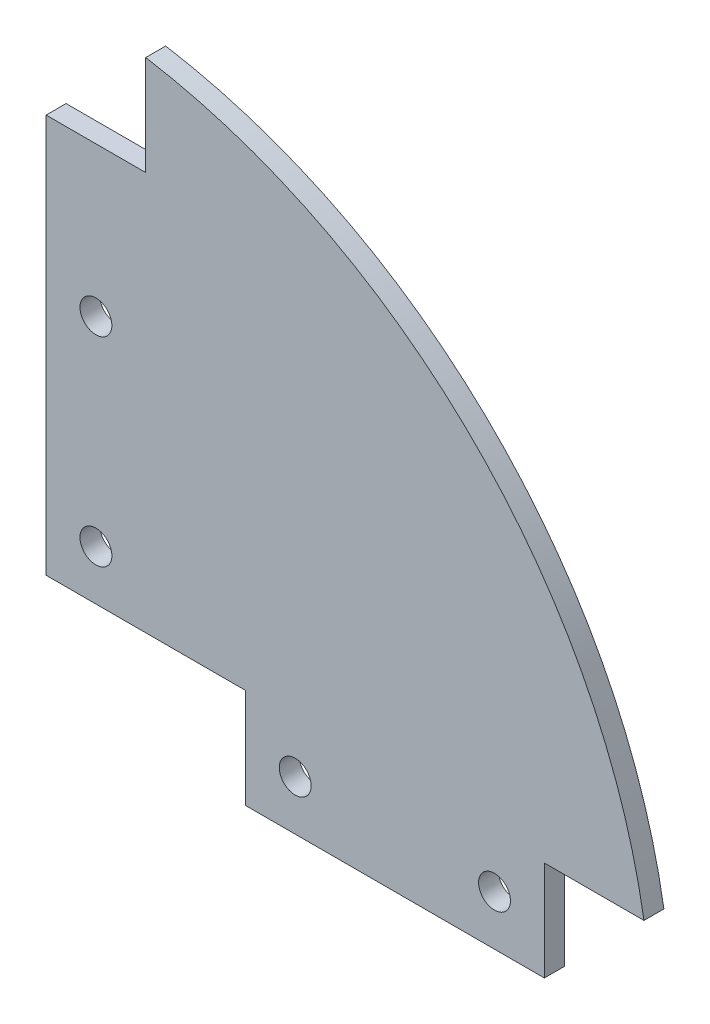
from build123d import *

# Parameters (mm, degrees)
SKETCH_1_R      = 1.6
EXTRUDE_1_DEPTH = 2


with BuildPart() as part:
    # ｽｹｯﾁ1 → ﾎﾞｽ - 押し出し1 (new body)
    with BuildSketch(Plane.XY):
        with BuildLine():
            Line((20, 0), (50, 0))
            Line((50, 0), (50, 10))
            Line((50, 10), (60, 10))
            ThreePointArc((60, 10), (43.011626335, 43.011626335), (10, 60))
            Line((10, 60), (10, 50))
            Line((10, 50), (0, 50))
            Line((0, 50), (0, 10))
            Line((0, 10), (20, 10))
            Line((20, 10), (20, 0))
        make_face()
        with Locations((5, 35)):
            Circle(SKETCH_1_R, mode=Mode.SUBTRACT)
        with Locations((5, 15)):
            Circle(SKETCH_1_R, mode=Mode.SUBTRACT)
        with Locations((25, 5)):
            Circle(SKETCH_1_R, mode=Mode.SUBTRACT)
        with Locations((45, 5)):
            Circle(SKETCH_1_R, mode=Mode.SUBTRACT)
    extrude(amount=EXTRUDE_1_DEPTH)


solid = part.part
